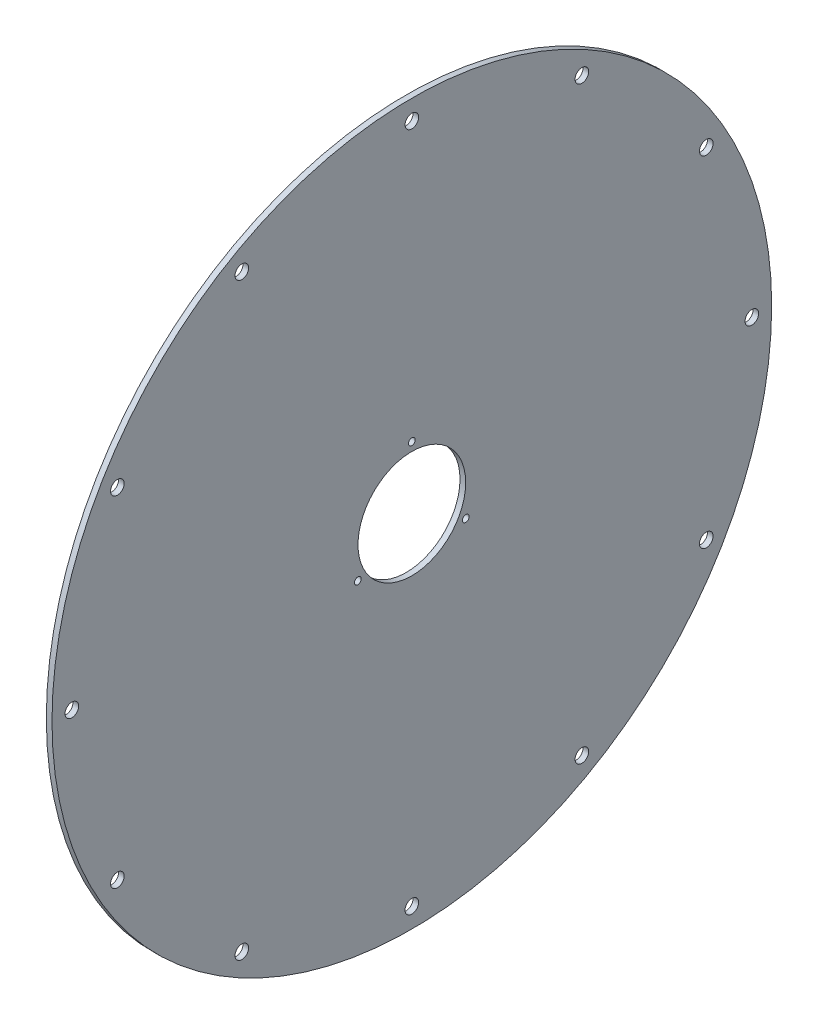
from build123d import *

# Parameters (mm, degrees)
SKETCH1_R           = 317.5
SKETCH1_R_2         = 47.5
BOSS_EXTRUDE1_DEPTH = 5
SKETCH2_R           = 6
CUT_EXTRUDE1_DEPTH  = 5
CIRPATTERN1_COUNT   = 12
SKETCH6_R           = 3
CUT_EXTRUDE2_DEPTH  = 10
CIRPATTERN2_COUNT   = 3


with BuildPart() as part:
    # Sketch1 → Boss-Extrude1 (new body)
    with BuildSketch(Plane(origin=(0, 0, 0), x_dir=(0, 0, -1), z_dir=(1, 0, 0))):
        Circle(SKETCH1_R)
        Circle(SKETCH1_R_2, mode=Mode.SUBTRACT)
    extrude(amount=BOSS_EXTRUDE1_DEPTH)

    # Sketch2 → Cut-Extrude1 (cut)
    with BuildSketch(Plane(origin=(5, 0, 0), x_dir=(0, 0, -1), z_dir=(1, 0, 0))):
        with Locations((300, 0)):
            Circle(SKETCH2_R)
    cut_extrude1 = extrude(amount=-CUT_EXTRUDE1_DEPTH, mode=Mode.SUBTRACT)

    # CirPattern1: Cut-Extrude1 ×12 about axis
    cirpattern1_axis = Axis((0, 0, 0), (1, 0, 0))
    for i in range(1, CIRPATTERN1_COUNT):
        add(cut_extrude1.rotate(cirpattern1_axis, i * 360 / CIRPATTERN1_COUNT), mode=Mode.SUBTRACT)

    # Sketch6 → Cut-Extrude2 (cut)
    with BuildSketch(Plane(origin=(5, 0, 0), x_dir=(0, 0, -1), z_dir=(1, 0, 0))):
        with Locations((0, 55)):
            Circle(SKETCH6_R)
    cut_extrude2 = extrude(amount=-CUT_EXTRUDE2_DEPTH, mode=Mode.SUBTRACT)

    # CirPattern2: Cut-Extrude2 ×3 about axis
    cirpattern2_axis = Axis((0, 0, 0), (1, 0, 0))
    for i in range(1, CIRPATTERN2_COUNT):
        add(cut_extrude2.rotate(cirpattern2_axis, i * 360 / CIRPATTERN2_COUNT), mode=Mode.SUBTRACT)


solid = part.part
